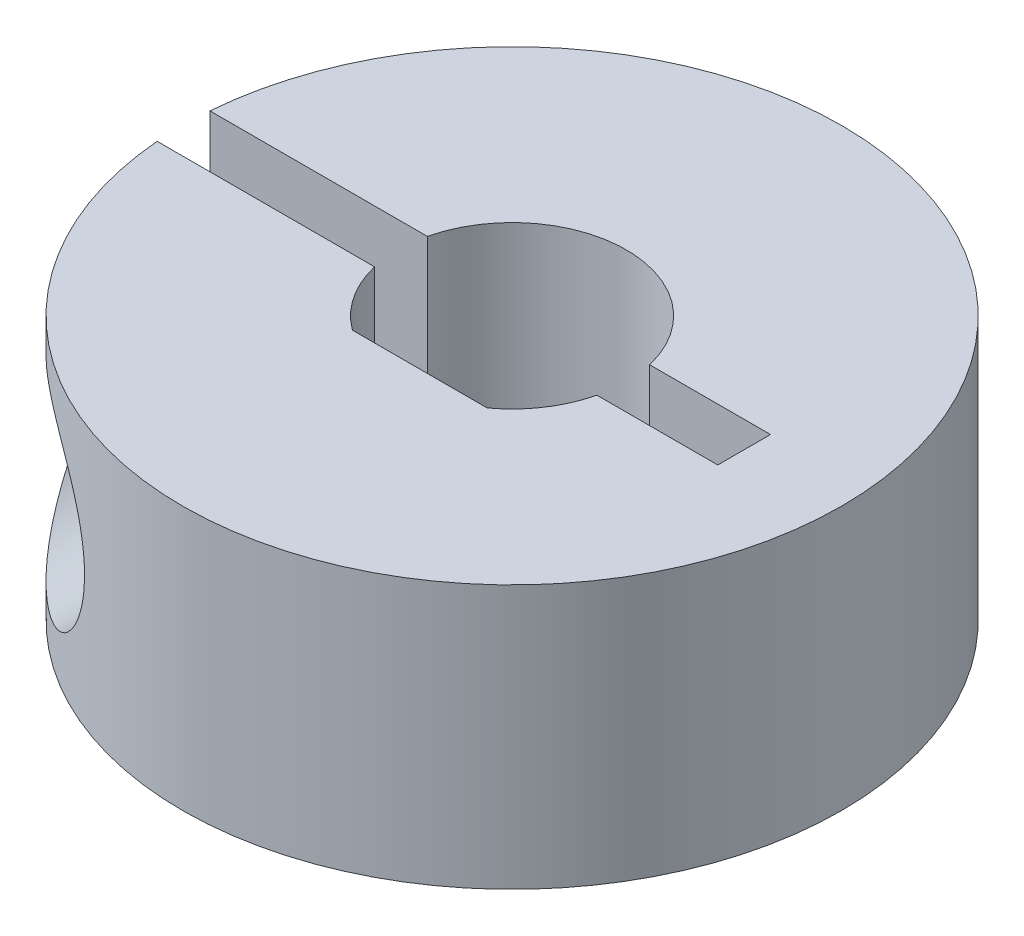
from build123d import *

# Parameters (mm, degrees)
BOSS_EXTRUDE1_DEPTH = 6
SKETCH4_R           = 1.2
CUT_EXTRUDE1_DEPTH  = 2
SKETCH5_R           = 2.25
CUT_EXTRUDE2_DEPTH  = 15.230249471
SKETCH9_R           = 1.085
CUT_EXTRUDE3_DEPTH  = 10


with BuildPart() as part:
    # Sketch2 → Boss-Extrude1 (new body)
    with BuildSketch(Plane(origin=(0, 0, 0), x_dir=(1, 0, 0), z_dir=(0, 1, 0))):
        with BuildLine():
            Line((-7.475961477, 0.6), (-2.529822128, 0.6))
            ThreePointArc((-2.529822128, 0.6), (0, 2.6), (2.529822128, 0.6))
            Line((2.529822128, 0.6), (5.279822128, 0.6))
            Line((5.279822128, 0.6), (5.279822128, -0.6))
            Line((5.279822128, -0.6), (2.529822128, -0.6))
            ThreePointArc((2.529822128, -0.6), (2.165426504, -1.439071943), (1.532970972, -2.1))
            Line((1.532970972, -2.1), (-1.532970972, -2.1))
            ThreePointArc((-1.532970972, -2.1), (-2.165426504, -1.439071943), (-2.529822128, -0.6))
            Line((-2.529822128, -0.6), (-7.475961477, -0.6))
            ThreePointArc((-7.475961477, -0.6), (7.5, 0), (-7.475961477, 0.6))
        make_face()
    extrude(amount=BOSS_EXTRUDE1_DEPTH)

    # Sketch4 → Cut-Extrude1 (cut)
    with BuildSketch(Plane.XY.offset(3)):
        with Locations((-5.1, 3)):
            Circle(SKETCH4_R)
    extrude(amount=-CUT_EXTRUDE1_DEPTH, mode=Mode.SUBTRACT)

    # Sketch5 → Cut-Extrude2 (cut, through all)
    with BuildSketch(Plane.XY.offset(3)):
        with Locations((-5.002891802, 3)):
            Circle(SKETCH5_R)
    extrude(amount=CUT_EXTRUDE2_DEPTH, mode=Mode.SUBTRACT)

    # Sketch9 → Cut-Extrude3 (cut)
    with BuildSketch(Plane.XY):
        with Locations((-5.1, 3)):
            Circle(SKETCH9_R)
    extrude(amount=-CUT_EXTRUDE3_DEPTH, mode=Mode.SUBTRACT)


solid = part.part
